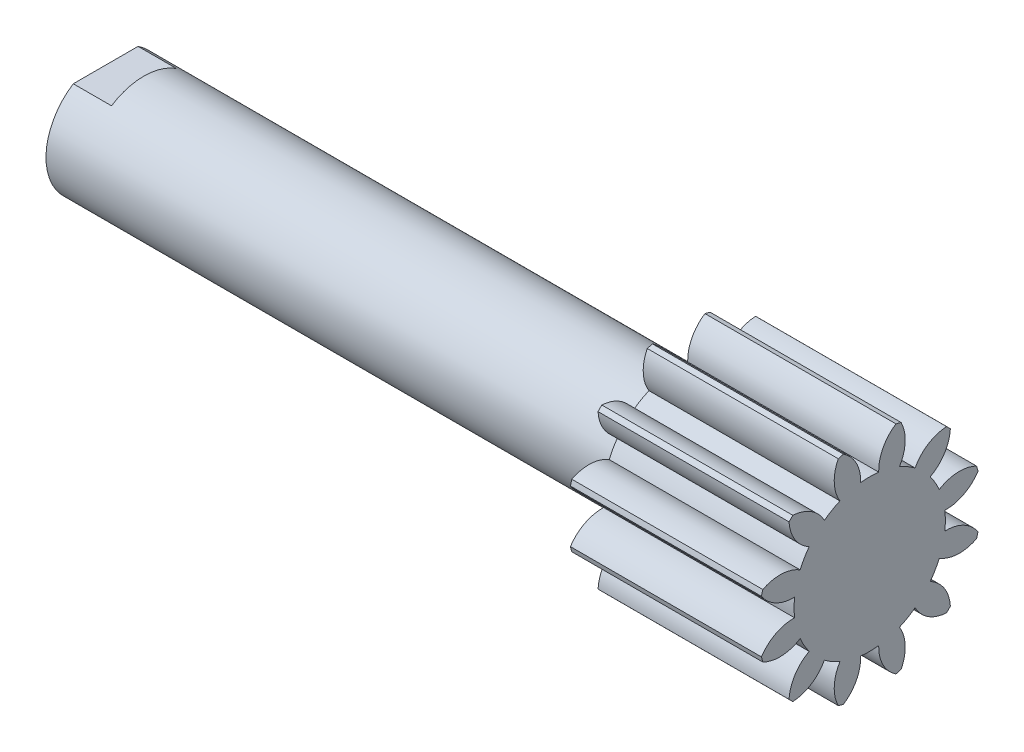
from build123d import *

# Parameters (mm, degrees)
BASPROSKE_W         = 12.7
BASPROSKE_H         = 7.408333333
TOOTHCUT_DEPTH      = 17.463802889
TEETHCUTS_COUNT     = 12
TEETHCUTS_ANGLE     = 330
BORSKE_R            = 3.96875
BOSS_EXTRUDE1_DEPTH = 38.1
SKETCH2_W           = 4.30677954
SKETCH2_H           = 1.27
CUT_EXTRUDE1_DEPTH  = 2.54


with BuildPart() as part:
    # BasProSke → Base-Revolve (revolve)
    with BuildSketch(Plane(origin=(0, 0, 0), x_dir=(1, 0, 0), z_dir=(0, 1, 0)), mode=Mode.PRIVATE) as base_revolve_sk:
        with Locations((6.35, 3.704166667)):
            Rectangle(BASPROSKE_W, BASPROSKE_H)
    revolve(base_revolve_sk.sketch.rotate(Axis((-10, 0, 0), (1, 0, 0)), 180), axis=Axis((-10, 0, 0), (1, 0, 0)))

    # TooCutSke → ToothCut (cut, through all)
    with BuildSketch(Plane(origin=(0, 0, 0), x_dir=(0, 0, -1), z_dir=(1, 0, 0))):
        with BuildLine():
            ThreePointArc((0.598297521, 4.993485027), (0, 5.0292), (-0.598297521, 4.993485027))
            ThreePointArc((-0.598297521, 4.993485027), (-0.89092307, 6.262076537), (-1.773623584, 7.219047766))
            ThreePointArc((-1.773623584, 7.219047766), (0, 7.433733333), (1.773623584, 7.219047766))
            ThreePointArc((1.773623584, 7.219047766), (0.89092307, 6.262076537), (0.598297521, 4.993485027))
        make_face()
    toothcut = extrude(amount=TOOTHCUT_DEPTH, mode=Mode.SUBTRACT)

    # TeethCuts: ToothCut ×12 about axis
    teethcuts_axis = Axis((-10, 0, 0), (1, 0, 0))
    for i in range(1, TEETHCUTS_COUNT):
        add(toothcut.rotate(teethcuts_axis, i * TEETHCUTS_ANGLE / (TEETHCUTS_COUNT - 1)), mode=Mode.SUBTRACT)

    # BorSke → Boss-Extrude1 (add)
    with BuildSketch(Plane(origin=(0, 0, 0), x_dir=(0, 0, -1), z_dir=(1, 0, 0))):
        Circle(BORSKE_R)
    extrude(amount=-BOSS_EXTRUDE1_DEPTH)

    # Sketch2 → Cut-Extrude1 (cut)
    with BuildSketch(Plane.ZY.offset(38.1)):
        with Locations((0, 3.96875)):
            Rectangle(SKETCH2_W, SKETCH2_H)
    extrude(amount=-CUT_EXTRUDE1_DEPTH, mode=Mode.SUBTRACT)


solid = part.part
